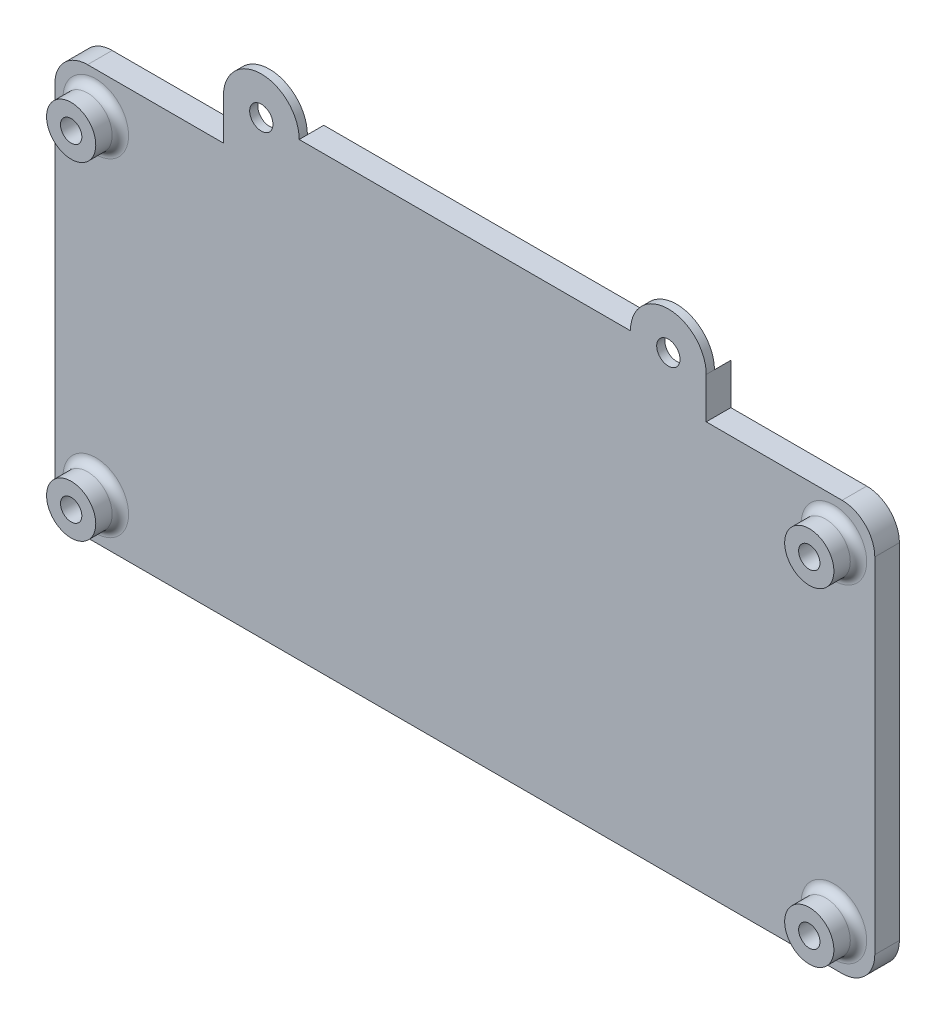
from build123d import *

# Parameters (mm, degrees)
SKETCH1_R           = 3
BOSS_EXTRUDE1_DEPTH = 3
SKETCH1_3_R         = 3
SKETCH1_3_R_2       = 1.3
BOSS_EXTRUDE2_DEPTH = 6
FILLET1_R           = 1
SKETCH2_R           = 1.4224
BOSS_EXTRUDE3_DEPTH = 3
CUT_EXTRUDE1_START  = -2
SKETCH6_R           = 4.618405104
CUT_EXTRUDE1_DEPTH  = 2


with BuildPart() as part:
    # Sketch1 → Boss-Extrude1 (new body)
    with BuildSketch(Plane.XY):
        with BuildLine():
            ThreePointArc((99.987500635, 4.00000762), (98.819645279, 1.180555381), (96.00019304, 0.012700025))
            Line((96.00019304, 0.012700025), (4.00000762, 0.012700025))
            ThreePointArc((4.00000762, 0.012700025), (1.180555381, 1.180555381), (0.012700025, 4.00000762))
            Line((0.012700025, 4.00000762), (0.012700025, 46.00009144))
            ThreePointArc((0.012700025, 46.00009144), (1.180555381, 48.819543679), (4.00000762, 49.987399035))
            Line((4.00000762, 49.987399035), (96.00019304, 49.987399035))
            ThreePointArc((96.00019304, 49.987399035), (98.819645279, 48.819543679), (99.987500635, 46.00009144))
            Line((99.987500635, 46.00009144), (99.987500635, 4.00000762))
        make_face()
        with Locations((95.0001905, 5.00001016)):
            Circle(SKETCH1_R, mode=Mode.SUBTRACT)
        with Locations((5.00001016, 5.00001016)):
            Circle(SKETCH1_R, mode=Mode.SUBTRACT)
        with Locations((95.0001905, 45.0000889)):
            Circle(SKETCH1_R, mode=Mode.SUBTRACT)
        with Locations((5.00001016, 45.0000889)):
            Circle(SKETCH1_R, mode=Mode.SUBTRACT)
    extrude(amount=BOSS_EXTRUDE1_DEPTH)

    # Sketch1<3> → Boss-Extrude2 (add)
    # profile 1 of 4: a face of its own
    with BuildSketch(Plane.XY):
        with Locations((5.00001016, 45.0000889)):
            Circle(SKETCH1_3_R)
        with Locations((5.00001016, 45.0000889)):
            Circle(SKETCH1_3_R_2, mode=Mode.SUBTRACT)
    # profile 2 of 4: a face of its own
    with BuildSketch(Plane.XY):
        with Locations((95.0001905, 45.0000889)):
            Circle(SKETCH1_3_R)
        with Locations((95.0001905, 45.0000889)):
            Circle(SKETCH1_3_R_2, mode=Mode.SUBTRACT)
    # profile 3 of 4: a face of its own
    with BuildSketch(Plane.XY):
        with Locations((95.0001905, 5.00001016)):
            Circle(SKETCH1_3_R)
        with Locations((95.0001905, 5.00001016)):
            Circle(SKETCH1_3_R_2, mode=Mode.SUBTRACT)
    # profile 4 of 4: a face of its own
    with BuildSketch(Plane.XY):
        with Locations((5.00001016, 5.00001016)):
            Circle(SKETCH1_3_R)
        with Locations((5.00001016, 5.00001016)):
            Circle(SKETCH1_3_R_2, mode=Mode.SUBTRACT)
    extrude(amount=BOSS_EXTRUDE2_DEPTH)

    # Fillet1
    fillet1_edges = [part.edges().sort_by_distance(p)[0] for p in [
        (92.0001905, 5.00001016, 3),
        (2.00001016, 5.00001016, 3),
        (92.0001905, 45.0000889, 3),
        (2.00001016, 45.0000889, 3),
    ]]
    fillet(fillet1_edges, radius=FILLET1_R)

    # Sketch2 → Boss-Extrude3 (add)
    with BuildSketch(Plane.XY.offset(3)):
        with BuildLine():
            Line((70.197495225, 54.987399035), (29.802705435, 54.987399035))
            ThreePointArc((29.802705434, 54.987399035), (25.18430033, 59.605804139), (20.565895226, 54.987399035))
            Line((20.565895225, 54.987399035), (20.565895225, 49.987399035))
            Line((20.565895225, 49.987399035), (79.434305435, 49.987399035))
            Line((79.434305435, 49.987399035), (79.434305435, 54.987399035))
            ThreePointArc((79.434305434, 54.987399035), (74.81590033, 59.605804139), (70.197495226, 54.987399035))
        make_face()
        with Locations((25.18430033, 54.987399035)):
            Circle(SKETCH2_R, mode=Mode.SUBTRACT)
        with Locations((74.81590033, 54.987399035)):
            Circle(SKETCH2_R, mode=Mode.SUBTRACT)
    extrude(amount=-BOSS_EXTRUDE3_DEPTH)

    # Sketch6 → Cut-Extrude1 (cut)
    with BuildSketch(Plane(origin=(0, 0, 0), x_dir=(-1, 0, 0), z_dir=(0, 0, -1)).offset(CUT_EXTRUDE1_START)):
        with Locations((-74.81590033, 54.987399035)):
            Circle(SKETCH6_R)
        with Locations((-25.18430033, 54.987399035)):
            Circle(SKETCH6_R)
    extrude(amount=CUT_EXTRUDE1_DEPTH, mode=Mode.SUBTRACT)


solid = part.part
